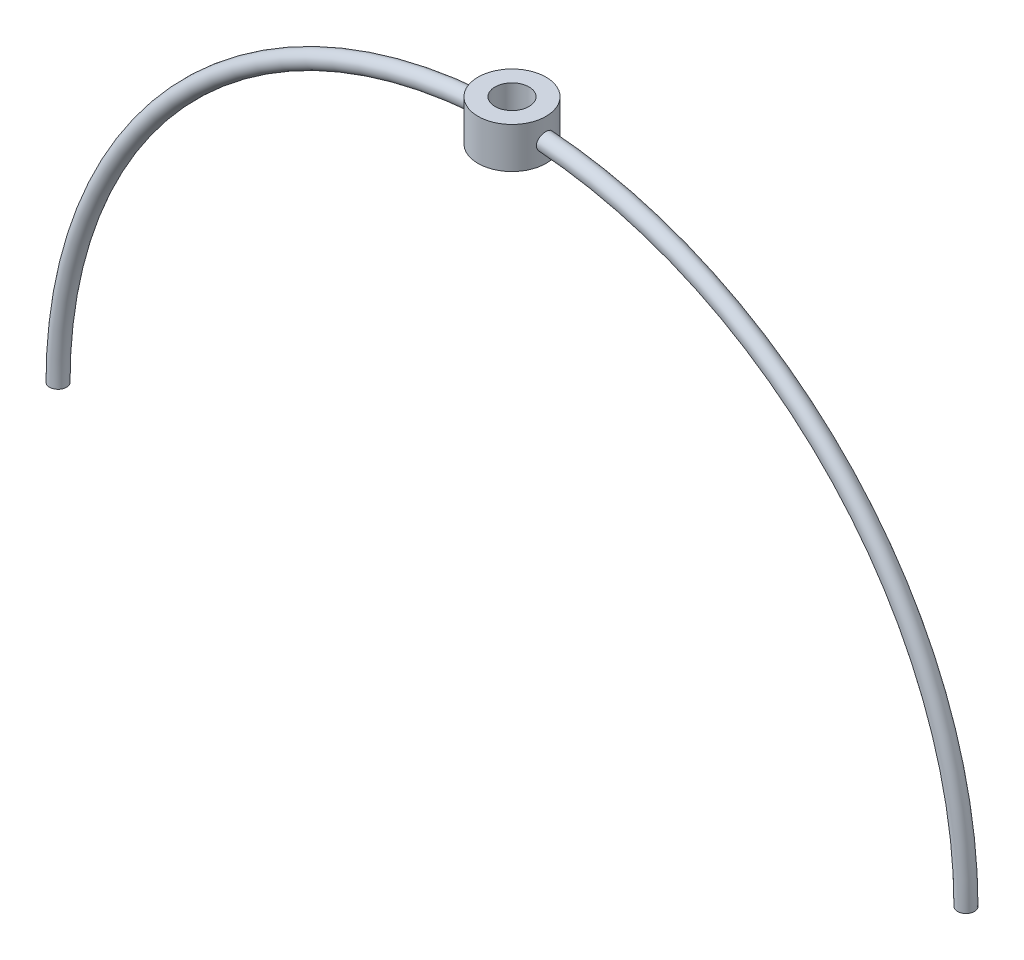
from build123d import *

# Parameters (mm, degrees)
SKETCH2_R                = 5
SKETCH2_R_2              = 3
BOSS_EXTRUDE1_DEPTH      = 12
BOSS_EXTRUDE1_DEPTH_BACK = 12
SKETCH3_R                = 20
SKETCH4_R                = 10
CUT_EXTRUDE1_DEPTH       = 32


with BuildPart() as part:
    # Sweep1: sweep along a path in Sketch1
    with BuildLine(Plane.XY) as sweep1_path:
        ThreePointArc((-267, -267), (0, 0), (267, -267))
    # Sketch2 → Sweep1 (sweep)
    with BuildSketch(Plane(origin=(0, 0, 0), x_dir=(0, 0, -1), z_dir=(1, 0, 0))):
        Circle(SKETCH2_R)
        Circle(SKETCH2_R_2, mode=Mode.SUBTRACT)
    sweep(path=sweep1_path.line)

    # Sketch3 → Boss-Extrude1 (add, two sides: drawn at the far end of the back side and taken through both)
    with BuildSketch(Plane(origin=(0, 0, 0), x_dir=(1, 0, 0), z_dir=(0, 1, 0)).offset(-BOSS_EXTRUDE1_DEPTH_BACK)):
        with Locations(Location((0, 0, 0), (0, 0, 270))):
            Circle(SKETCH3_R)
    extrude(amount=BOSS_EXTRUDE1_DEPTH + BOSS_EXTRUDE1_DEPTH_BACK)

    # Sketch4 → Cut-Extrude1 (cut)
    with BuildSketch(Plane(origin=(0, 12, 0), x_dir=(1, 0, 0), z_dir=(0, 1, 0))):
        with Locations(Location((0, 0, 0), (0, 0, 270))):
            Circle(SKETCH4_R)
    extrude(amount=-CUT_EXTRUDE1_DEPTH, mode=Mode.SUBTRACT)


solid = part.part
